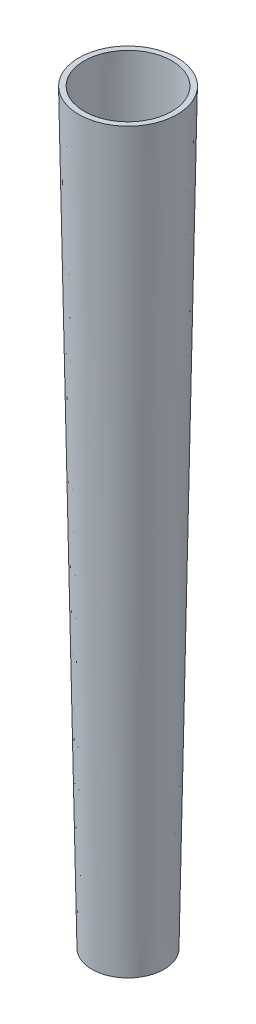
from build123d import *

# Parameters (mm, degrees)
SKETCH2_R          = 3.500152328
CUT_EXTRUDE1_DEPTH = 161
CUT_EXTRUDE1_DRAFT = 1


with BuildPart() as part:
    # Sketch1 → Revolve2 (revolve)
    with BuildSketch(Plane.XY, mode=Mode.PRIVATE) as revolve2_sk:
        Polygon((-2.517455065, 1), (-4.94370909, 140), (-5.943861418, 140), (-3.500152328, 0), (-2.5, 0), (0, 0), (0, 1), align=None)
        Polygon((-5.769337354, 0), (-8.213046444, 140), (-9.213198772, 140), (-6.769489682, 0), align=None)
    revolve(revolve2_sk.sketch.rotate(Axis((0, 0, 0), (0, 1, 0)), 270), axis=Axis((0, 0, 0), (0, 1, 0)))


with BuildPart() as cut_extrude1_tool:
    # Sketch2 → Cut-Extrude1 (with draft: the straight prism first)
    with BuildSketch(Plane(origin=(0, 0, 0), x_dir=(-1, 0, 0), z_dir=(0, -1, 0))):
        Circle(SKETCH2_R)
    extrude(amount=-CUT_EXTRUDE1_DEPTH)
    # Cut-Extrude1: the draft: its side faces are tilted about the plane it starts from
    cut_extrude1_sides = [cut_extrude1_tool.faces().sort_by_distance(p)[0] for p in [
        (3.500152328, 80.5, 0),
    ]]
    draft(cut_extrude1_sides, Plane(origin=(0, 0, 0), x_dir=(-1, 0, 0), z_dir=(0, -1, 0)), CUT_EXTRUDE1_DRAFT)


with BuildPart() as part_1:
    add(part.part)

    # Cut-Extrude1: cut by cut_extrude1_tool
    add(cut_extrude1_tool.part, mode=Mode.SUBTRACT)


solid = part_1.part
